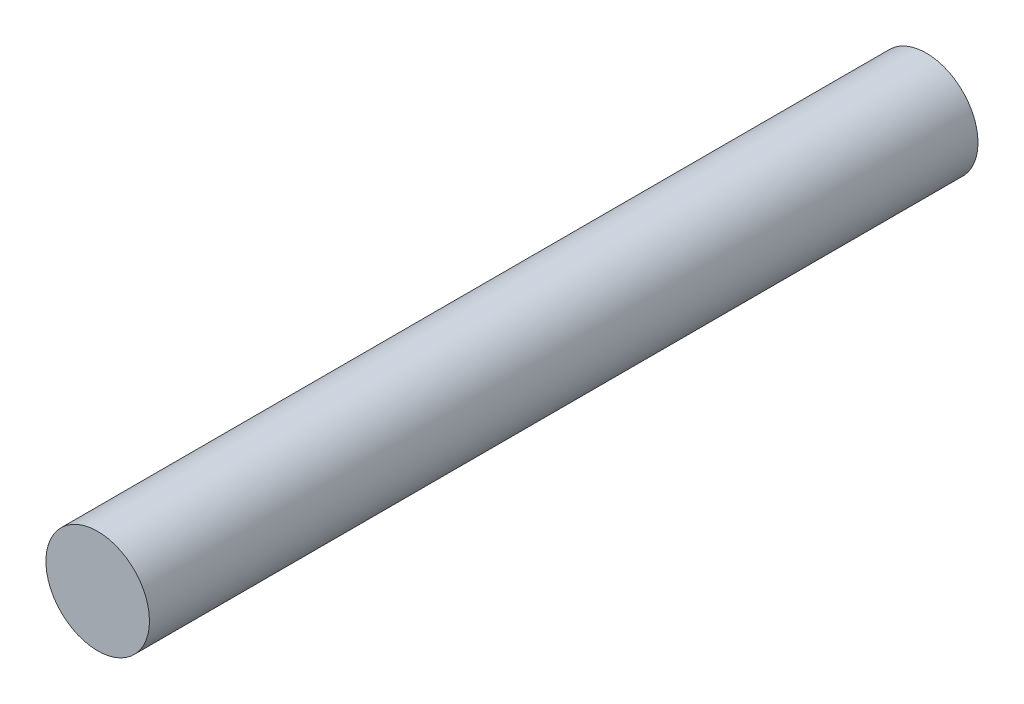
from build123d import *

# Parameters (mm, degrees)
SKETCH1_R           = 1.5875
BOSS_EXTRUDE1_DEPTH = 25.4
SKETCH2_R           = 1.016
CUT_EXTRUDE1_DEPTH  = 5.08


with BuildPart() as part:
    # Sketch1 → Boss-Extrude1 (new body)
    with BuildSketch(Plane.XY):
        Circle(SKETCH1_R)
    extrude(amount=BOSS_EXTRUDE1_DEPTH)

    # Sketch2 → Cut-Extrude1 (cut)
    with BuildSketch(Plane(origin=(0, 0, 0), x_dir=(-1, 0, 0), z_dir=(0, 0, -1))):
        Circle(SKETCH2_R)
    extrude(amount=-CUT_EXTRUDE1_DEPTH, mode=Mode.SUBTRACT)


solid = part.part
